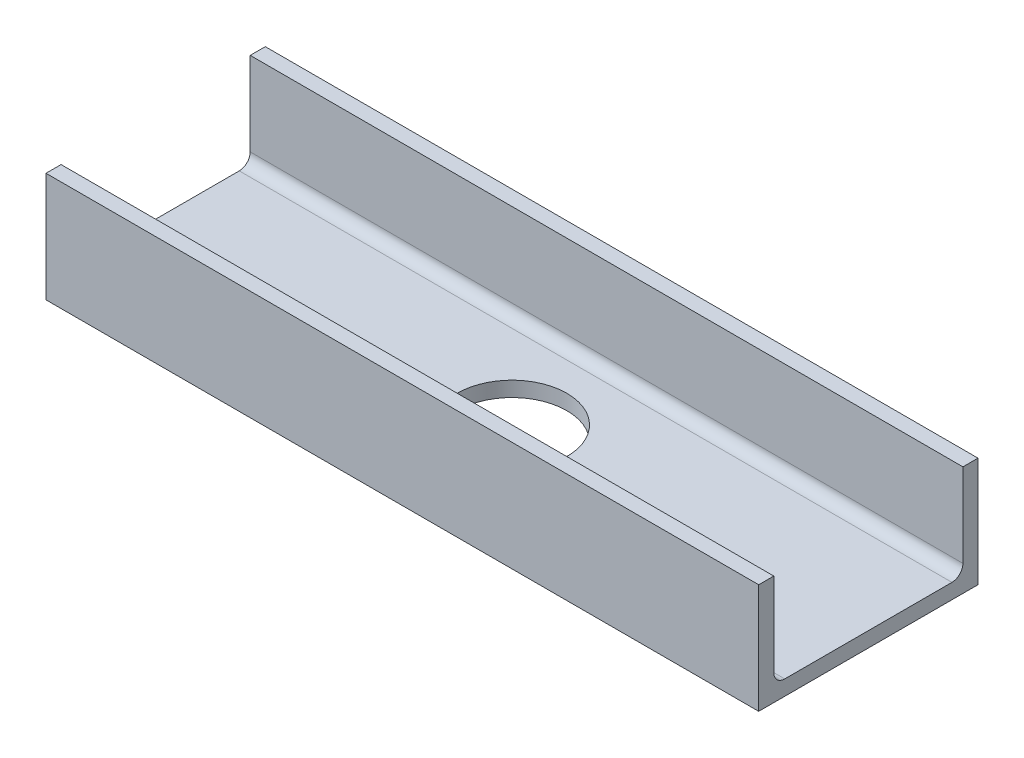
from build123d import *

# Parameters (mm, degrees)
BOSS_EXTRUDE1_DEPTH = 165.1
SKETCH2_R           = 12.7
CUT_EXTRUDE1_DEPTH  = 11.938


with BuildPart() as part:
    # Sketch1 → Boss-Extrude1 (new body)
    with BuildSketch(Plane(origin=(0, 0, 0), x_dir=(0, 0, -1), z_dir=(1, 0, 0))):
        with BuildLine():
            Line((-21.9075, -6.6675), (-21.9075, 9.2075))
            Line((-21.9075, 9.2075), (-21.9075, 12.7))
            Line((-21.9075, 12.7), (-25.4, 12.7))
            Line((-25.4, 12.7), (-25.4, -12.7))
            Line((-25.4, -12.7), (25.4, -12.7))
            Line((25.4, -12.7), (25.4, 12.7))
            Line((25.4, 12.7), (21.9075, 12.7))
            Line((21.9075, 12.7), (21.9075, 9.2075))
            Line((21.9075, 9.2075), (21.9075, -6.6675))
            ThreePointArc((21.9075, -6.6675), (21.163551224, -8.463551224), (19.3675, -9.2075))
            Line((19.3675, -9.2075), (-19.3675, -9.2075))
            ThreePointArc((-19.3675, -9.2075), (-21.163551224, -8.463551224), (-21.9075, -6.6675))
        make_face()
    extrude(amount=-BOSS_EXTRUDE1_DEPTH)

    # Sketch2 → Cut-Extrude1 (cut)
    with BuildSketch(Plane.XZ.offset(12.7)):
        with Locations(Location((-82.55, 0, 0), (0, 0, 270))):
            Circle(SKETCH2_R)
    extrude(amount=-CUT_EXTRUDE1_DEPTH, mode=Mode.SUBTRACT)


solid = part.part
